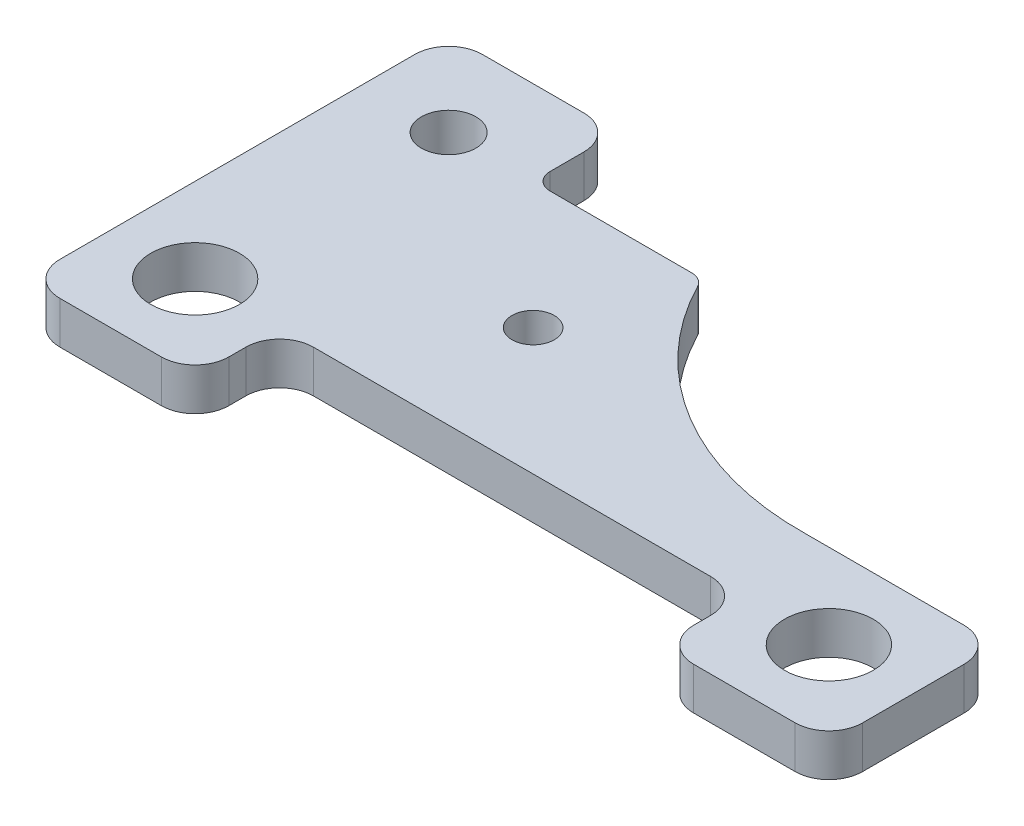
from build123d import *

# Parameters (mm, degrees)
SKETCH1_R           = 5.25
SKETCH1_R_2         = 2.5
SKETCH1_R_3         = 3.225
BOSS_EXTRUDE1_DEPTH = 5


with BuildPart() as part:
    # Sketch1 → Boss-Extrude1 (new body)
    with BuildSketch(Plane(origin=(0, 0, 0), x_dir=(1, 0, 0), z_dir=(0, 1, 0))):
        with BuildLine():
            ThreePointArc((4, 0), (1.171572875, -1.171572875), (0, -4))
            Line((0, -4), (0, -46))
            ThreePointArc((0, -46), (1.171572875, -48.828427125), (4, -50))
            Line((4, -50), (16, -50))
            ThreePointArc((16, -50), (18.828427125, -48.828427125), (20, -46))
            Line((20, -46), (20, -44))
            ThreePointArc((20, -44), (21.171572875, -41.171572875), (24, -40))
            Line((24, -40), (71, -40))
            ThreePointArc((71, -40), (73.828427125, -41.171572875), (75, -44))
            Line((75, -44), (75, -46))
            ThreePointArc((75, -46), (76.171572875, -48.828427125), (79, -50))
            Line((79, -50), (91, -50))
            ThreePointArc((91, -50), (93.828427125, -48.828427125), (95, -46))
            Line((95, -46), (95, -34))
            ThreePointArc((95, -34), (93.828427125, -31.171572875), (91, -30))
            Line((91, -30), (72.250853642, -30))
            ThreePointArc((72.250853642, -30), (71.625426821, -30.005588428), (71, -30))
            ThreePointArc((71, -30), (53.160847909, -24.738723573), (40.535736829, -11.081383158))
            ThreePointArc((40.535736829, -11.081383158), (39.799078859, -10.291604015), (38.759183115, -10))
            Line((38.759183115, -10), (22, -10))
            ThreePointArc((22, -10), (20.585786438, -9.414213562), (20, -8))
            Line((20, -8), (20, -4))
            ThreePointArc((20, -4), (18.828427125, -1.171572875), (16, 0))
            Line((16, 0), (4, 0))
        make_face()
        with Locations(Location((10, -40, 0), (0, 0, 270))):
            Circle(SKETCH1_R, mode=Mode.SUBTRACT)
        with Locations(Location((85, -40, 0), (0, 0, 270))):
            Circle(SKETCH1_R, mode=Mode.SUBTRACT)
        with Locations(Location((35, -25, 0), (0, 0, 270))):
            Circle(SKETCH1_R_2, mode=Mode.SUBTRACT)
        with Locations(Location((10, -10, 0), (0, 0, 270))):
            Circle(SKETCH1_R_3, mode=Mode.SUBTRACT)
    extrude(amount=BOSS_EXTRUDE1_DEPTH)


solid = part.part
